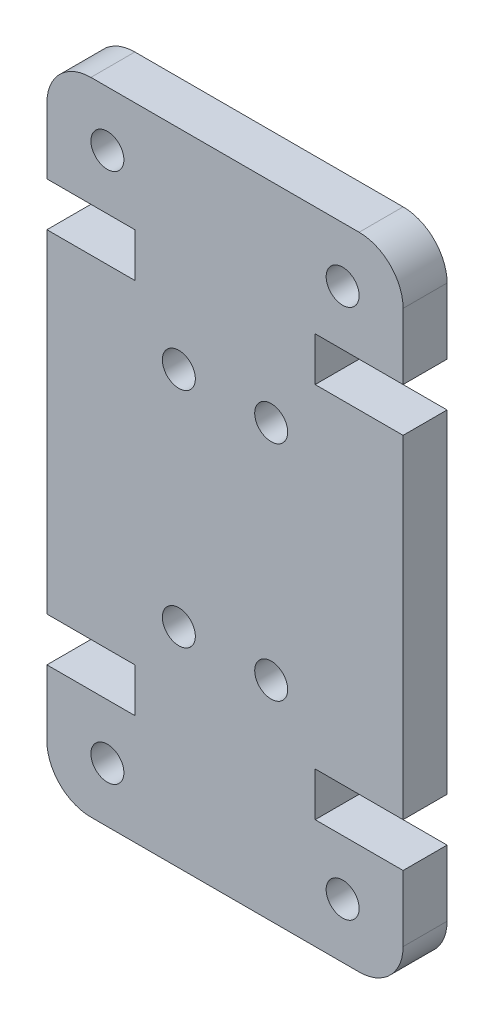
from build123d import *

# Parameters (mm, degrees)
SKETCH1_R           = 0.75
BOSS_EXTRUDE1_DEPTH = 2


with BuildPart() as part:
    # Sketch1 → Boss-Extrude1 (new body)
    with BuildSketch(Plane.XY):
        with BuildLine():
            Line((0, 22.14), (0, 7))
            Line((0, 7), (4, 7))
            Line((4, 7), (4, 5))
            Line((4, 5), (0, 5))
            Line((0, 5), (0, 2))
            ThreePointArc((0, 2), (0.585786438, 0.585786438), (2, 0))
            Line((2, 0), (14.2, 0))
            ThreePointArc((14.2, 0), (15.614213562, 0.585786438), (16.2, 2))
            Line((16.2, 2), (16.2, 5))
            Line((16.2, 5), (12.2, 5))
            Line((12.2, 5), (12.2, 7))
            Line((12.2, 7), (16.2, 7))
            Line((16.2, 7), (16.2, 22.14))
            Line((16.2, 22.14), (12.2, 22.14))
            Line((12.2, 22.14), (12.2, 24.14))
            Line((12.2, 24.14), (16.2, 24.14))
            Line((16.2, 24.14), (16.2, 27.14))
            ThreePointArc((16.2, 27.14), (15.614213562, 28.554213562), (14.2, 29.14))
            Line((14.2, 29.14), (2, 29.14))
            ThreePointArc((2, 29.14), (0.585786438, 28.554213562), (0, 27.14))
            Line((0, 27.14), (0, 24.14))
            Line((0, 24.14), (4, 24.14))
            Line((4, 24.14), (4, 22.14))
            Line((4, 22.14), (0, 22.14))
        make_face()
        with Locations(Location((13.45, 2.5, 0), (0, 0, 180))):
            Circle(SKETCH1_R, mode=Mode.SUBTRACT)
        with Locations(Location((10.2, 9.5, 0), (0, 0, 180))):
            Circle(SKETCH1_R, mode=Mode.SUBTRACT)
        with Locations(Location((2.75, 26.64, 0), (0, 0, 180))):
            Circle(SKETCH1_R, mode=Mode.SUBTRACT)
        with Locations(Location((6, 19.64, 0), (0, 0, 180))):
            Circle(SKETCH1_R, mode=Mode.SUBTRACT)
        with Locations((6, 9.5)):
            Circle(SKETCH1_R, mode=Mode.SUBTRACT)
        with Locations((2.75, 2.5)):
            Circle(SKETCH1_R, mode=Mode.SUBTRACT)
        with Locations((10.2, 19.64)):
            Circle(SKETCH1_R, mode=Mode.SUBTRACT)
        with Locations((13.45, 26.64)):
            Circle(SKETCH1_R, mode=Mode.SUBTRACT)
    extrude(amount=BOSS_EXTRUDE1_DEPTH)


solid = part.part
